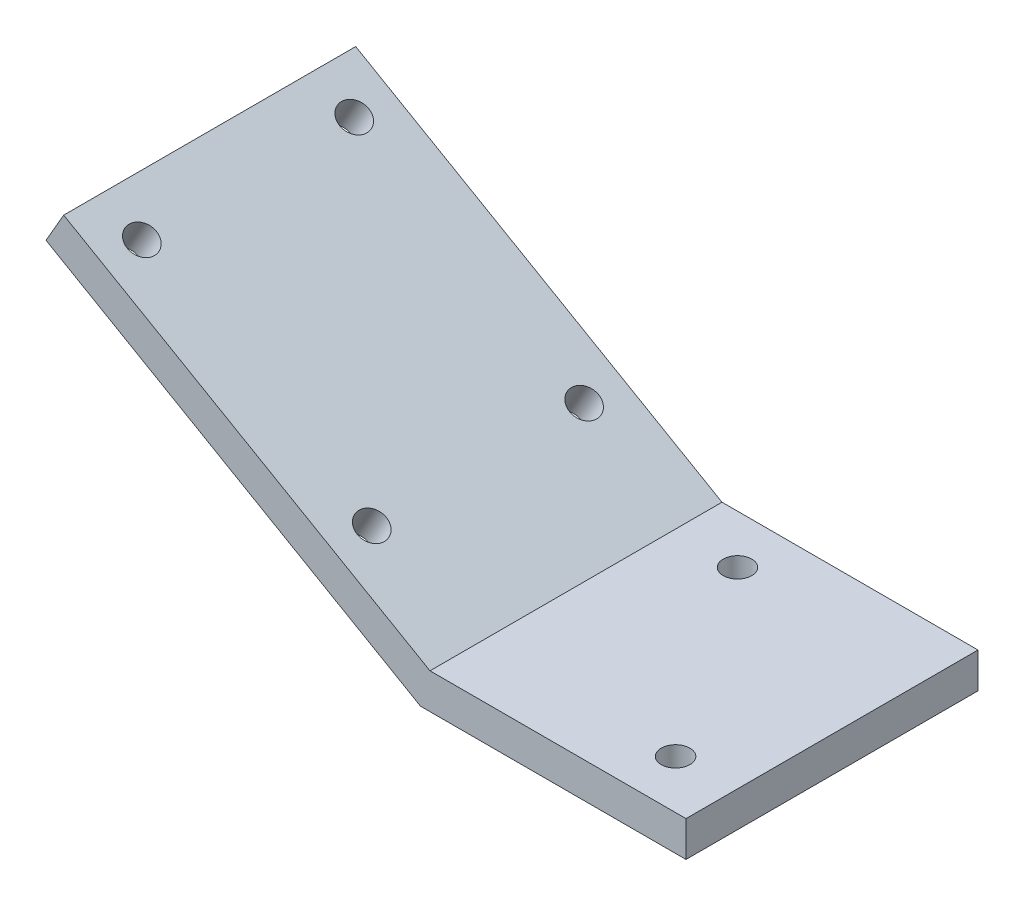
from build123d import *

# Parameters (mm, degrees)
SKETCH1_W           = 50
SKETCH1_H           = 23
BOSS_EXTRUDE1_DEPTH = 20
CUT_EXTRUDE3_DEPTH  = 30
CUT_EXTRUDE4_DEPTH  = 30
SKETCH9_W           = 23
SKETCH9_H           = 4
BOSS_EXTRUDE2_DEPTH = 20
BOSS_EXTRUDE3_DEPTH = 10
SKETCH14_R          = 1.65
CUT_EXTRUDE6_DEPTH  = 10
SKETCH22_W          = 33
SKETCH22_H          = 4
BOSS_EXTRUDE4_DEPTH = 5
CUT_EXTRUDE7_DEPTH  = 5


with BuildPart() as part:
    # Sketch1 → Boss-Extrude1 (new body)
    with BuildSketch(Plane(origin=(0, 0, 0), x_dir=(1, 0, 0), z_dir=(0, 1, 0))):
        Rectangle(SKETCH1_W, SKETCH1_H)
    extrude(amount=BOSS_EXTRUDE1_DEPTH)

    # Sketch2 → Cut-Extrude3 (cut)
    with BuildSketch(Plane.XY.offset(11.5)):
        Polygon((0, 0), (-25, 14.43375673), (-25, 0), align=None)
        Polygon((1.07179677, 4), (25, 4), (25, 20), (-25, 20), (-25, 19.052558883), align=None)
    extrude(amount=-CUT_EXTRUDE3_DEPTH, mode=Mode.SUBTRACT)

    # Sketch4 → Cut-Extrude4 (cut)
    with BuildSketch(Plane.XY.offset(11.5)):
        Polygon((-25, 14.43375673), (-23, 17.897858345), (-25, 19.052558883), align=None)
    extrude(amount=-CUT_EXTRUDE4_DEPTH, mode=Mode.SUBTRACT)

    # Sketch9 → Boss-Extrude2 (add)
    with BuildSketch(Plane(origin=(-25, 14.43375673, 0), x_dir=(0, 0, 1), z_dir=(-0.8660254037844407, 0.4999999999999965, 0))):
        with Locations((0, 2)):
            Rectangle(SKETCH9_W, SKETCH9_H)
    extrude(amount=BOSS_EXTRUDE2_DEPTH)

    # Sketch11 → Boss-Extrude3 (add)
    with BuildSketch(Plane(origin=(0, 0, -11.5), x_dir=(-1, 0, 0), z_dir=(0, 0, -1))):
        Polygon((-25, 4), (-1.07179677, 4), (40.320508076, 27.897858345), (42.320508076, 24.43375673), (0, 0), (-25, 0), align=None)
    extrude(amount=BOSS_EXTRUDE3_DEPTH)

    # Sketch14 → Cut-Extrude6 (cut)
    with BuildSketch(Plane(origin=(2, 3.464101615, 0), x_dir=(0.866025403784438, -0.5000000000000012, 0), z_dir=(0.5000000000000011, 0.8660254037844379, 0))):
        with Locations(Location((-43.867513459, 17, 0), (0, 0, 180))):
            Circle(SKETCH14_R)
        with Locations(Location((-43.867513459, -7, 0), (0, 0, 180))):
            Circle(SKETCH14_R)
        with Locations(Location((-13.867513459, 17, 0), (0, 0, 180))):
            Circle(SKETCH14_R)
        with Locations(Location((-13.867513459, -7, 0), (0, 0, 180))):
            Circle(SKETCH14_R)
    extrude(amount=-CUT_EXTRUDE6_DEPTH, mode=Mode.SUBTRACT)

    # Sketch22 → Boss-Extrude4 (add)
    with BuildSketch(Plane(origin=(25, 0, 0), x_dir=(0, 0, -1), z_dir=(1, 0, 0))):
        with Locations((5, 2)):
            Rectangle(SKETCH22_W, SKETCH22_H)
    extrude(amount=BOSS_EXTRUDE4_DEPTH)

    # Sketch23 → Cut-Extrude7 (cut)
    with BuildSketch(Plane.XZ):
        with BuildLine():
            ThreePointArc((23.322235494, 7.62), (22.176722509, 4.854487014), (24.942235494, 6))
            Line((24.942235494, 6), (23.322235494, 6))
            Line((23.322235494, 6), (23.322235494, 7.62))
        make_face()
        with BuildLine():
            Line((23.322235494, 6), (24.942235494, 6))
            ThreePointArc((24.942235494, 6), (24.46774848, 7.145512986), (23.322235494, 7.62))
            Line((23.322235494, 7.62), (23.322235494, 6))
        make_face()
        with BuildLine():
            ThreePointArc((6.702235494, -16), (7.176722509, -17.145512986), (8.322235494, -17.62))
            Line((8.322235494, -17.62), (8.322235494, -16))
            Line((8.322235494, -16), (6.702235494, -16))
        make_face()
        with BuildLine():
            Line((8.322235494, -16), (8.322235494, -17.62))
            ThreePointArc((8.322235494, -17.62), (9.46774848, -17.145512986), (9.942235494, -16))
            ThreePointArc((9.942235494, -16), (8.322235494, -14.38), (6.702235494, -16))
            Line((6.702235494, -16), (8.322235494, -16))
        make_face()
    extrude(amount=-CUT_EXTRUDE7_DEPTH, mode=Mode.SUBTRACT)


solid = part.part
